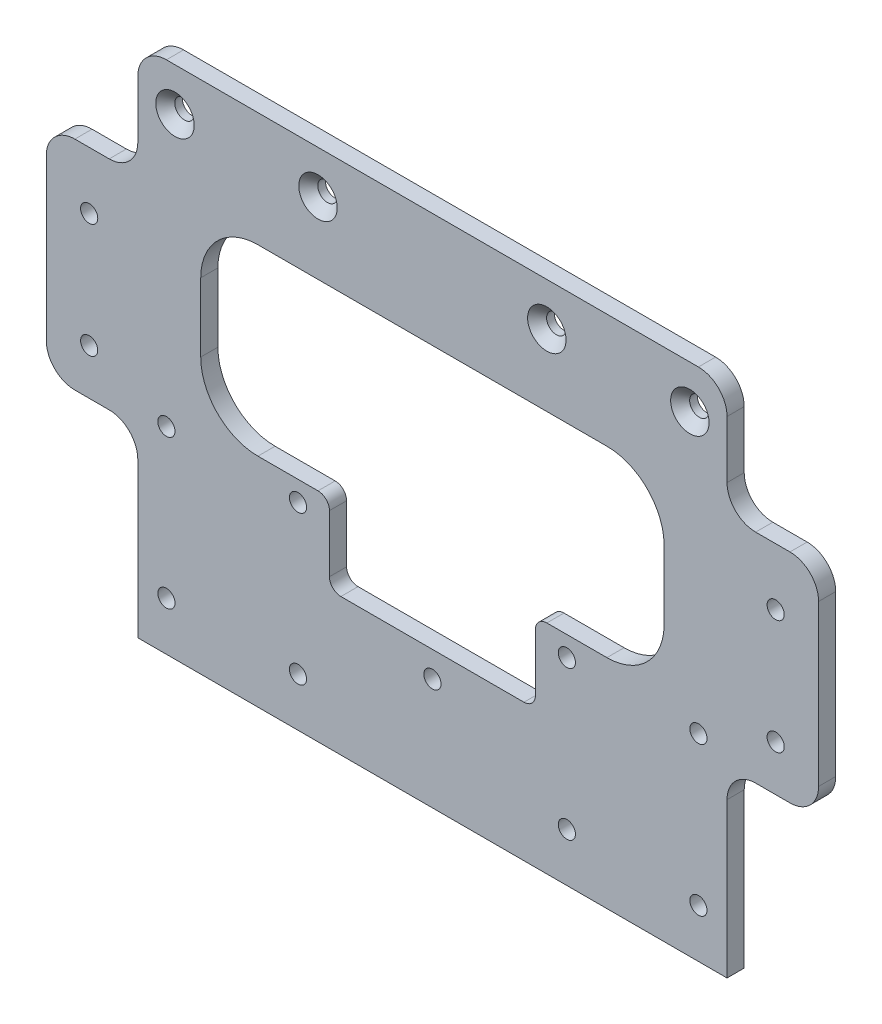
from build123d import *

# Parameters (mm, degrees)
EXTRUDE_1_DEPTH             = 3
FILLET_1_R                  = 5
SKETCH_2_R                  = 1.5
CUT_EXTRUDE_1_DEPTH         = 113.539992891
SKETCH_4_R                  = 1.5
CUT_EXTRUDE_2_DEPTH         = 113.539992891
SKETCH_6_R                  = 1.5
CUT_EXTRUDE_3_DEPTH         = 113.539992891
SKETCH_7_W                  = 81
SKETCH_7_H                  = 32
CUT_EXTRUDE_4_DEPTH         = 113.539992891
FILLET_2_R                  = 10
SKETCH_8_W                  = 36
SKETCH_8_H                  = 14
CUT_EXTRUDE_5_DEPTH         = 113.539992891
FILLET_3_R                  = 2
HOLE_WIZARD_M3_1_AT_2_COUNT = 2
HOLE_WIZARD_M3_1_AT_2_PITCH = 25
HOLE_WIZARD_M3_1_AT_3_COUNT = 2
HOLE_WIZARD_M3_1_AT_3_PITCH = 65
HOLE_WIZARD_M3_1_AT_4_COUNT = 2
HOLE_WIZARD_M3_1_AT_4_PITCH = 90


with BuildPart() as part:
    # 草图1 → 凸台-拉伸1 (new body)
    with BuildSketch(Plane.XY):
        Polygon((51.5, 90), (-51.5, 90), (-51.5, 70), (-67.5, 70), (-67.5, 32), (-51.5, 32), (-51.5, 0), (51.5, 0), (51.5, 32), (67.5, 32), (67.5, 70), (51.5, 70), align=None)
    extrude(amount=EXTRUDE_1_DEPTH)

    # 圆角1
    fillet_1_edges = [part.edges().sort_by_distance(p)[0] for p in [
        (-51.5, 70, 1.5),
        (-51.5, 90, 1.5),
        (51.5, 90, 1.5),
        (51.5, 70, 1.5),
        (67.5, 70, 1.5),
        (67.5, 32, 1.5),
        (51.5, 32, 1.5),
        (-51.5, 32, 1.5),
        (-67.5, 32, 1.5),
        (-67.5, 70, 1.5),
    ]]
    fillet(fillet_1_edges, radius=FILLET_1_R)

    # 草图2 → 切除-拉伸1 (cut, through all)
    with BuildSketch(Plane.XY.offset(3)):
        with Locations((-45, 82.5)):
            Circle(SKETCH_2_R)
        with Locations(Location((45, 82.5, 0), (0, 0, 180))):
            Circle(SKETCH_2_R)
        with Locations((-20, 82.5)):
            Circle(SKETCH_2_R)
        with Locations(Location((20, 82.5, 0), (0, 0, 180))):
            Circle(SKETCH_2_R)
        with Locations((-60, 60)):
            Circle(SKETCH_2_R)
        with Locations(Location((60, 60, 0), (0, 0, 180))):
            Circle(SKETCH_2_R)
        with Locations((-60, 40)):
            Circle(SKETCH_2_R)
        with Locations(Location((60, 40, 0), (0, 0, 180))):
            Circle(SKETCH_2_R)
    extrude(amount=-CUT_EXTRUDE_1_DEPTH, mode=Mode.SUBTRACT)

    # 草图4 → 切除-拉伸2 (cut, through all)
    with BuildSketch(Plane.XY.offset(3)):
        with Locations((-46.5, 34.5)):
            Circle(SKETCH_4_R)
        with Locations((-23.5, 34.5)):
            Circle(SKETCH_4_R)
        with Locations((-23.5, 8.5)):
            Circle(SKETCH_4_R)
        with Locations((-46.5, 8.5)):
            Circle(SKETCH_4_R)
        with Locations(Location((46.5, 8.5, 0), (0, 0, 180))):
            Circle(SKETCH_4_R)
        with Locations(Location((23.5, 8.5, 0), (0, 0, 180))):
            Circle(SKETCH_4_R)
        with Locations(Location((23.5, 34.5, 0), (0, 0, 180))):
            Circle(SKETCH_4_R)
        with Locations(Location((46.5, 34.5, 0), (0, 0, 180))):
            Circle(SKETCH_4_R)
    extrude(amount=-CUT_EXTRUDE_2_DEPTH, mode=Mode.SUBTRACT)

    # 草图6 → 切除-拉伸3 (cut, through all)
    with BuildSketch(Plane.XY.offset(3)):
        with Locations((0, 19.5)):
            Circle(SKETCH_6_R)
    extrude(amount=-CUT_EXTRUDE_3_DEPTH, mode=Mode.SUBTRACT)

    # 草图7 → 切除-拉伸4 (cut, through all)
    with BuildSketch(Plane.XY.offset(3)):
        with Locations((0, 54)):
            Rectangle(SKETCH_7_W, SKETCH_7_H)
    extrude(amount=-CUT_EXTRUDE_4_DEPTH, mode=Mode.SUBTRACT)

    # 圆角2
    fillet_2_edges = [part.edges().sort_by_distance(p)[0] for p in [
        (40.5, 70, 1.5),
        (40.5, 38, 1.5),
        (-40.5, 38, 1.5),
        (-40.5, 70, 1.5),
    ]]
    fillet(fillet_2_edges, radius=FILLET_2_R)

    # 草图8 → 切除-拉伸5 (cut, through all)
    with BuildSketch(Plane.XY.offset(3)):
        with Locations((0, 31)):
            Rectangle(SKETCH_8_W, SKETCH_8_H)
    extrude(amount=-CUT_EXTRUDE_5_DEPTH, mode=Mode.SUBTRACT)

    # 圆角3
    fillet_3_edges = [part.edges().sort_by_distance(p)[0] for p in [
        (-18, 24, 1.5),
        (-18, 38, 1.5),
        (18, 38, 1.5),
        (18, 24, 1.5),
    ]]
    fillet(fillet_3_edges, radius=FILLET_3_R)

    # 草图9 → M3 六角凹锥坑螺钉的锥形沉头孔1 (revolve, cut)
    with BuildSketch(Plane(origin=(-45, 82.5, 3), x_dir=(0, -1, 0), z_dir=(1, 0, 0))):
        Polygon((0, 0), (0, 3), (1.7, 3), (1.7, 1.66), (3.36, 0), align=None)
    hole_wizard_m3_1 = revolve(axis=Axis((-45, 82.5, 9.35), (0, 0, -1)), mode=Mode.SUBTRACT)

    # M3 六角凹锥坑螺钉的锥形沉头孔1 at 2: M3 六角凹锥坑螺钉的锥形沉头孔1 ×2
    with Locations(*[(i * HOLE_WIZARD_M3_1_AT_2_PITCH, 0, 0) for i in range(1, HOLE_WIZARD_M3_1_AT_2_COUNT)]):
        add(hole_wizard_m3_1, mode=Mode.SUBTRACT)

    # M3 六角凹锥坑螺钉的锥形沉头孔1 at 3: M3 六角凹锥坑螺钉的锥形沉头孔1 ×2
    with Locations(*[(i * HOLE_WIZARD_M3_1_AT_3_PITCH, 0, 0) for i in range(1, HOLE_WIZARD_M3_1_AT_3_COUNT)]):
        add(hole_wizard_m3_1, mode=Mode.SUBTRACT)

    # M3 六角凹锥坑螺钉的锥形沉头孔1 at 4: M3 六角凹锥坑螺钉的锥形沉头孔1 ×2
    with Locations(*[(i * HOLE_WIZARD_M3_1_AT_4_PITCH, 0, 0) for i in range(1, HOLE_WIZARD_M3_1_AT_4_COUNT)]):
        add(hole_wizard_m3_1, mode=Mode.SUBTRACT)


solid = part.part
